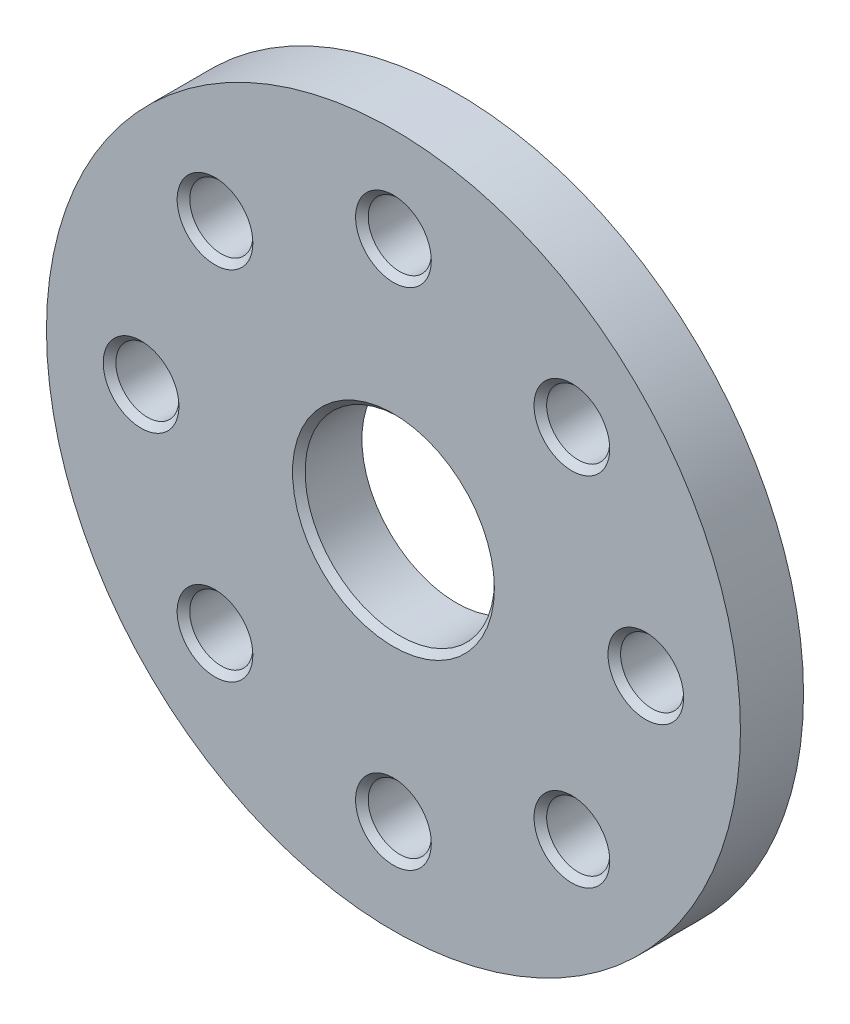
from build123d import *

# Parameters (mm, degrees)
SKETCH1_R           = 11
BOSS_EXTRUDE1_DEPTH = 2
SKETCH3_R           = 3
CUT_EXTRUDE1_DEPTH  = 16.684387141
SKETCH4_R           = 1
CUT_EXTRUDE2_DEPTH  = 16.684387141
CHAMFER1_SIZE       = 0.2
CHAMFER2_SIZE       = 0.2
CIRPATTERN1_COUNT   = 8
CHAMFER4_SIZE       = 0.2
CHAMFER5_SIZE       = 0.2
CHAMFER6_SIZE       = 0.2


with BuildPart() as part:
    # Sketch1 → Boss-Extrude1 (new body)
    with BuildSketch(Plane.XY):
        Circle(SKETCH1_R)
    extrude(amount=BOSS_EXTRUDE1_DEPTH)

    # Sketch3 → Cut-Extrude1 (cut, through all)
    with BuildSketch(Plane.XY.offset(2)):
        Circle(SKETCH3_R)
    extrude(amount=-CUT_EXTRUDE1_DEPTH, mode=Mode.SUBTRACT)

    # Sketch4 → Cut-Extrude2 (cut, through all)
    with BuildSketch(Plane.XY.offset(2)):
        with Locations((0, 8)):
            Circle(SKETCH4_R)
    cut_extrude2 = extrude(amount=-CUT_EXTRUDE2_DEPTH, mode=Mode.SUBTRACT)

    # Chamfer1
    chamfer1_edges = [part.edges().sort_by_distance(p)[0] for p in [
        (-1, 8, 2),
    ]]
    chamfer(chamfer1_edges, length=CHAMFER1_SIZE)

    # Chamfer2
    chamfer2_edges = [part.edges().sort_by_distance(p)[0] for p in [
        (-3, 0, 2),
    ]]
    chamfer(chamfer2_edges, length=CHAMFER2_SIZE)

    # CirPattern1: Cut-Extrude2 ×8 about axis
    cirpattern1_axis = Axis((0, 0, 0), (0, 0, 1))
    for i in range(1, CIRPATTERN1_COUNT):
        add(cut_extrude2.rotate(cirpattern1_axis, i * 360 / CIRPATTERN1_COUNT), mode=Mode.SUBTRACT)

    # Chamfer4
    chamfer4_edges = [part.edges().sort_by_distance(p)[0] for p in [
        (-4.949747468, -6.363961031, 2),
    ]]
    chamfer(chamfer4_edges, length=CHAMFER4_SIZE)

    # Chamfer5
    chamfer5_edges = [part.edges().sort_by_distance(p)[0] for p in [
        (8, 1, 2),
        (4.949747468, 6.363961031, 2),
    ]]
    chamfer(chamfer5_edges, length=CHAMFER5_SIZE)

    # Chamfer6
    chamfer6_edges = [part.edges().sort_by_distance(p)[0] for p in [
        (-6.363961031, 4.949747468, 2),
        (-8, -1, 2),
        (1, -8, 2),
        (6.363961031, -4.949747468, 2),
    ]]
    chamfer(chamfer6_edges, length=CHAMFER6_SIZE)


solid = part.part
